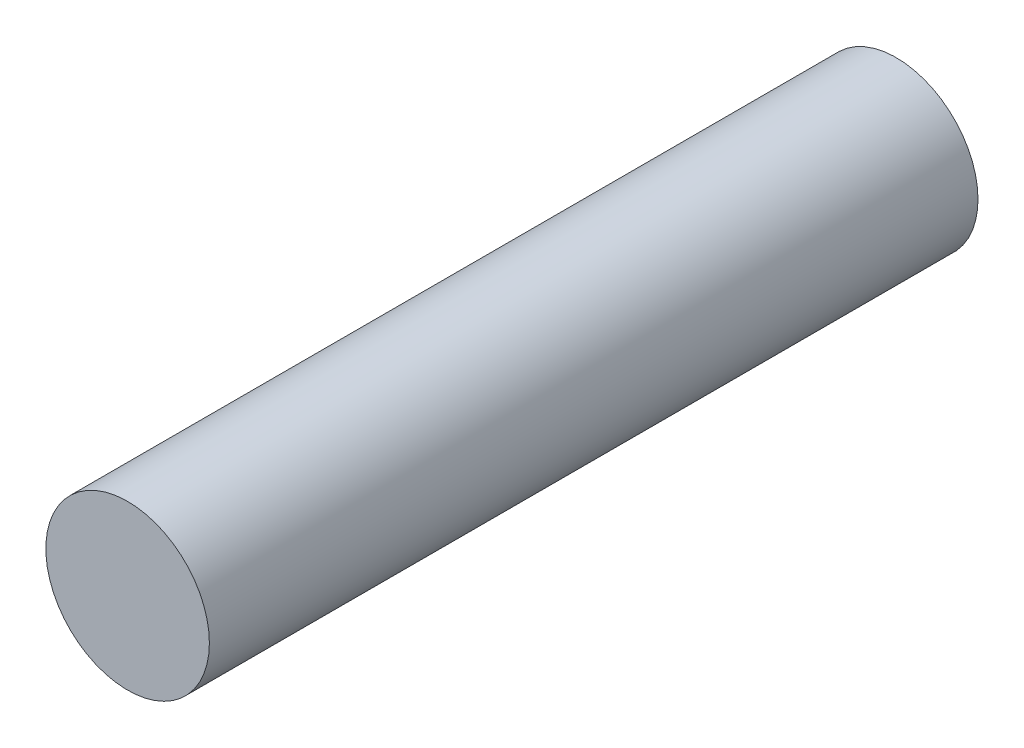
from build123d import *

# Parameters (mm, degrees)
SKETCH1_R           = 5
BOSS_EXTRUDE1_DEPTH = 47


with BuildPart() as part:
    # Sketch1 → Boss-Extrude1 (new body)
    with BuildSketch(Plane.XY):
        Circle(SKETCH1_R)
    extrude(amount=BOSS_EXTRUDE1_DEPTH)


solid = part.part
